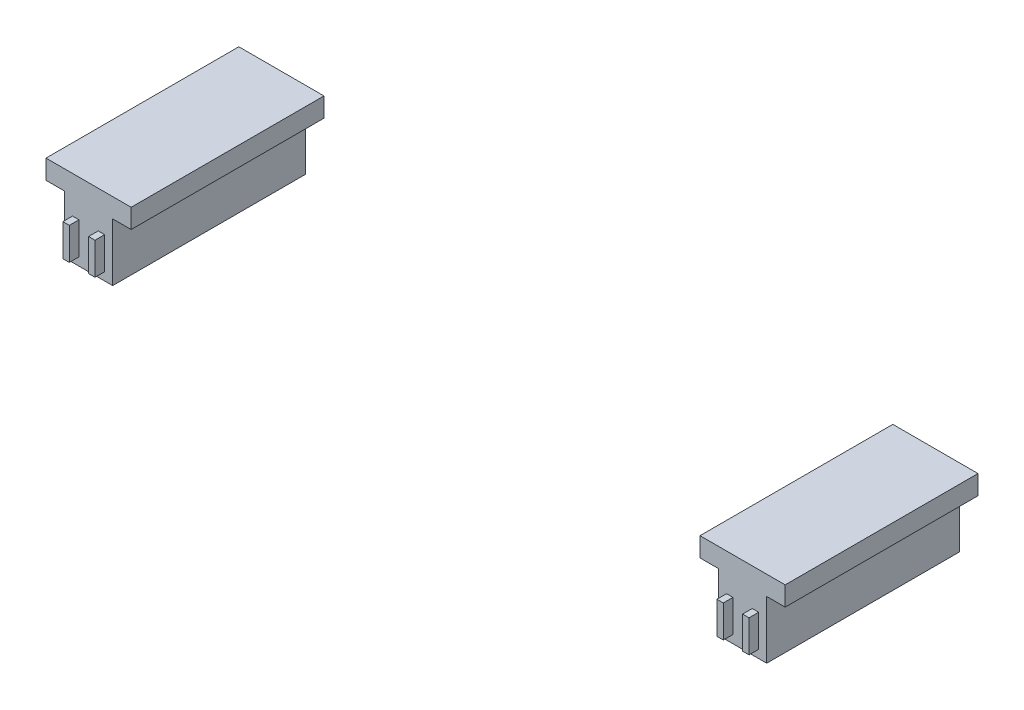
from build123d import *

# Parameters (mm, degrees)
BOSS_EXTRUDE1_DEPTH   = 60
BOSS_EXTRUDE1_2_DEPTH = 60
SKETCH2_W             = 2
SKETCH2_H             = 10
BOSS_EXTRUDE2_DEPTH   = 3


with BuildPart() as part:
    # Sketch1 → Boss-Extrude1 (new body)
    with BuildSketch(Plane.XY):
        Polygon((-56.516255203, -7.740004899), (-56.516255203, -25.740004899), (-71.516255203, -25.740004899), (-71.516255203, -7.740004899), (-77.266255203, -7.740004899), (-77.266255203, -1.740004899), (-50.766255203, -1.740004899), (-50.766255203, -7.740004899), align=None)
    extrude(amount=BOSS_EXTRUDE1_DEPTH)



with BuildPart() as body_2:
    # Sketch1 → Boss-Extrude1 2 (new body)
    with BuildSketch(Plane.XY):
        Polygon((146.983744797, -25.740004899), (146.983744797, -7.740004899), (152.733744797, -7.740004899), (152.733744797, -1.740004899), (126.233744797, -1.740004899), (126.233744797, -7.740004899), (131.983744797, -7.740004899), (131.983744797, -25.740004899), align=None)
    extrude(amount=BOSS_EXTRUDE1_2_DEPTH)


with BuildPart() as part_1:
    add(part.part)

    add(body_2.part)  # Boss-Extrude2 merges body 2
    # Sketch2 → Boss-Extrude2 (add)
    with BuildSketch(Plane.XY.offset(60)):
        with Locations((-68.016255203, -18.240004899)):
            Rectangle(SKETCH2_W, SKETCH2_H)
        with Locations((-60.016255203, -18.240004899)):
            Rectangle(SKETCH2_W, SKETCH2_H)
        with Locations((135.483744797, -18.240004899)):
            Rectangle(SKETCH2_W, SKETCH2_H)
        with Locations((143.483744797, -18.240004899)):
            Rectangle(SKETCH2_W, SKETCH2_H)
    extrude(amount=BOSS_EXTRUDE2_DEPTH)


solid = part_1.part
